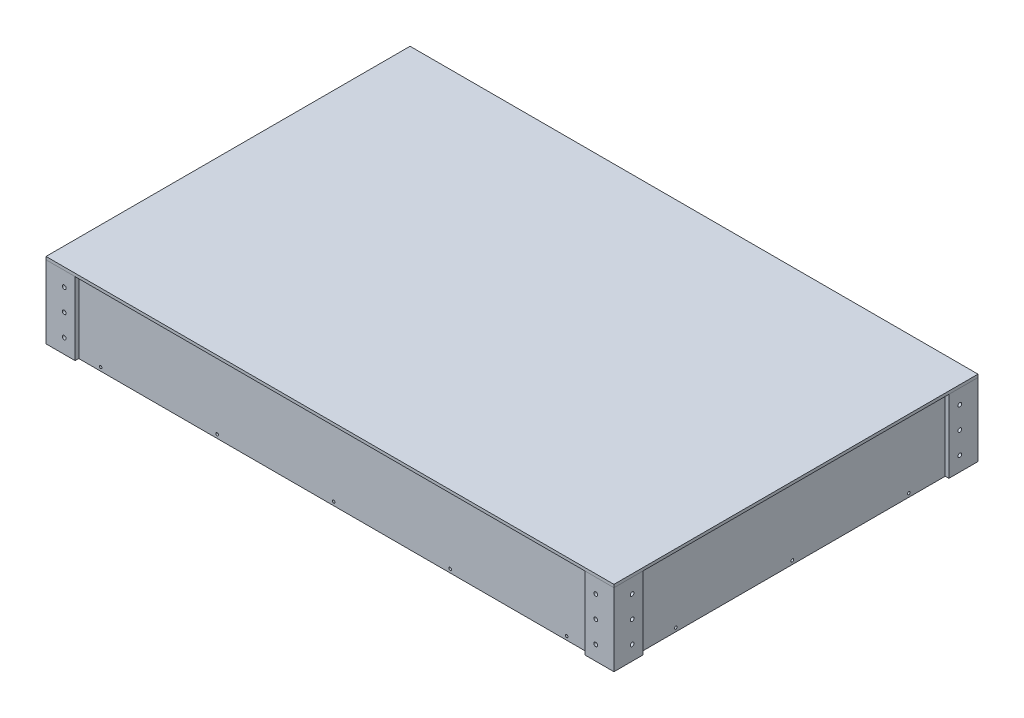
from build123d import *

# Parameters (mm, degrees)
SKETCH1_W                  = 482.6
SKETCH1_H                  = 304.8
BOSS_EXTRUDE1_DEPTH        = 6.35
BOSS_EXTRUDE2_DEPTH        = 57.15
BOSS_EXTRUDE2_DEPTH_BACK   = 6.35
SKETCH2_W                  = 482.6
SKETCH2_H                  = 3.175
BOSS_EXTRUDE2_2_DEPTH      = 57.15
BOSS_EXTRUDE2_2_DEPTH_BACK = 6.35
BOSS_EXTRUDE3_START        = -6.35
SKETCH3_W                  = 3.175
SKETCH3_H                  = 311.15
BOSS_EXTRUDE3_DEPTH        = 63.5
BOSS_EXTRUDE3_2_DEPTH      = 63.5
BOSS_EXTRUDE4_DEPTH        = 63.5
SKETCH5_R                  = 1.651
CUT_EXTRUDE1_DEPTH         = 406.170307556
SKETCH6_R                  = 1.651
CUT_EXTRUDE2_DEPTH         = 524.980822645
CUT_EXTRUDE3_DEPTH         = 406.170307556
CUT_EXTRUDE3_DEPTH_BACK    = 406.170307556
SKETCH7_R                  = 1.1811
SKETCH8_R                  = 1.1811
CUT_EXTRUDE4_DEPTH         = 521.980640835
SKETCH9_W                  = 495.3
SKETCH9_H                  = 317.5
BOSS_EXTRUDE5_DEPTH        = 2.54
SKETCH11_R                 = 1.651
CUT_EXTRUDE6_DEPTH         = 3.175
SKETCH13_R                 = 1.651
CUT_EXTRUDE8_DEPTH         = 301.15826009
SKETCH14_R                 = 6.35
CUT_EXTRUDE9_DEPTH         = 301.15826009


with BuildPart() as part:
    # Sketch1 → Boss-Extrude1 (new body)
    with BuildSketch(Plane(origin=(0, 0, 0), x_dir=(1, 0, 0), z_dir=(0, 1, 0))):
        Rectangle(SKETCH1_W, SKETCH1_H)
    extrude(amount=BOSS_EXTRUDE1_DEPTH)

    # Sketch13 → Cut-Extrude8 (cut, through all)
    with BuildSketch(Plane(origin=(0, 6.35, 0), x_dir=(1, 0, 0), z_dir=(0, 1, 0))):
        with Locations(Location((-228.6, 127, 0), (0, 0, 270))):
            Circle(SKETCH13_R)
        with Locations(Location((228.6, 127, 0), (0, 0, 270))):
            Circle(SKETCH13_R)
        with Locations(Location((228.6, -127, 0), (0, 0, 270))):
            Circle(SKETCH13_R)
        with Locations(Location((-228.6, -127, 0), (0, 0, 270))):
            Circle(SKETCH13_R)
    extrude(amount=-CUT_EXTRUDE8_DEPTH, mode=Mode.SUBTRACT)

    # Sketch14 → Cut-Extrude9 (cut, through all)
    with BuildSketch(Plane(origin=(0, 6.35, 0), x_dir=(1, 0, 0), z_dir=(0, 1, 0))):
        with Locations(Location((152.4, 127, 0), (0, 0, 270))):
            Circle(SKETCH14_R)
        with Locations(Location((152.4, -127, 0), (0, 0, 270))):
            Circle(SKETCH14_R)
        with Locations(Location((19.05, -127, 0), (0, 0, 270))):
            Circle(SKETCH14_R)
        with Locations(Location((19.05, 127, 0), (0, 0, 270))):
            Circle(SKETCH14_R)
        with Locations(Location((-114.3, 127, 0), (0, 0, 270))):
            Circle(SKETCH14_R)
        with Locations(Location((-114.3, -127, 0), (0, 0, 270))):
            Circle(SKETCH14_R)
    extrude(amount=-CUT_EXTRUDE9_DEPTH, mode=Mode.SUBTRACT)


with BuildPart() as body_2:
    # Sketch2 → Boss-Extrude2 (new, two sides: drawn at the far end of the back side and taken through both)
    with BuildSketch(Plane(origin=(0, 6.35, 0), x_dir=(1, 0, 0), z_dir=(0, 1, 0)).offset(-BOSS_EXTRUDE2_DEPTH_BACK)):
        with Locations((0, 153.9875)):
            Rectangle(SKETCH2_W, SKETCH2_H)
    extrude(amount=BOSS_EXTRUDE2_DEPTH + BOSS_EXTRUDE2_DEPTH_BACK)


with BuildPart() as body_3:
    # Sketch2 → Boss-Extrude2 2 (new, two sides: drawn at the far end of the back side and taken through both)
    with BuildSketch(Plane(origin=(0, 6.35, 0), x_dir=(1, 0, 0), z_dir=(0, 1, 0)).offset(-BOSS_EXTRUDE2_2_DEPTH_BACK)):
        with Locations((0, -153.9875)):
            Rectangle(SKETCH2_W, SKETCH2_H)
    extrude(amount=BOSS_EXTRUDE2_2_DEPTH + BOSS_EXTRUDE2_2_DEPTH_BACK)


with BuildPart() as body_4:
    # Sketch3 → Boss-Extrude3 (new body)
    with BuildSketch(Plane(origin=(0, 6.35, 0), x_dir=(1, 0, 0), z_dir=(0, 1, 0)).offset(BOSS_EXTRUDE3_START)):
        with Locations((-242.8875, 0)):
            Rectangle(SKETCH3_W, SKETCH3_H)
    extrude(amount=BOSS_EXTRUDE3_DEPTH)


with BuildPart() as body_5:
    # Sketch3 → Boss-Extrude3 2 (new body)
    with BuildSketch(Plane(origin=(0, 6.35, 0), x_dir=(1, 0, 0), z_dir=(0, 1, 0)).offset(BOSS_EXTRUDE3_START)):
        with Locations((242.8875, 0)):
            Rectangle(SKETCH3_W, SKETCH3_H)
    extrude(amount=BOSS_EXTRUDE3_2_DEPTH)


with BuildPart() as body_6:
    # Sketch4 → Boss-Extrude4 (new body)
    with BuildSketch(Plane.XZ):
        Polygon((-244.475, -155.575), (-222.25, -155.575), (-222.25, -158.75), (-247.65, -158.75), (-247.65, -133.35), (-244.475, -133.35), align=None)
    extrude(amount=-BOSS_EXTRUDE4_DEPTH)


with BuildPart() as body_7:
    # Mirror1: mirrored copy
    add(body_6.part.mirror(Plane(origin=(0, 0, 0), x_dir=(0, 0, 1), z_dir=(1, 0, 0))))


with BuildPart() as body_8:
    # Mirror2: mirrored copy
    add(body_6.part.mirror(Plane.XY))


with BuildPart() as body_9:
    # Mirror2 2: mirrored copy
    add(body_7.part.mirror(Plane.XY))


with BuildPart() as cut_extrude1_tool:
    # Sketch5 → Cut-Extrude1 (new, through all)
    with BuildSketch(Plane(origin=(0, 0, -155.575), x_dir=(-1, 0, 0), z_dir=(0, 0, -1))):
        with Locations((-231.775, 50.8)):
            Circle(SKETCH5_R)
        with Locations((-231.775, 31.75)):
            Circle(SKETCH5_R)
        with Locations((-231.775, 12.7)):
            Circle(SKETCH5_R)
    cut_extrude1 = extrude(amount=-CUT_EXTRUDE1_DEPTH)


with BuildPart() as body_2_1:
    add(body_2.part)

    # Cut-Extrude1: cut by cut_extrude1_tool
    add(cut_extrude1_tool.part, mode=Mode.SUBTRACT)


with BuildPart() as body_3_1:
    add(body_3.part)

    # Cut-Extrude1: cut by cut_extrude1_tool
    add(cut_extrude1_tool.part, mode=Mode.SUBTRACT)


with BuildPart() as body_9_1:
    add(body_9.part)

    # Cut-Extrude1: cut by cut_extrude1_tool
    add(cut_extrude1_tool.part, mode=Mode.SUBTRACT)


with BuildPart() as mirror3_tool:
    # Mirror3: Cut-Extrude1 across plane
    add(cut_extrude1.mirror(Plane(origin=(0, 0, 0), x_dir=(0, 0, 1), z_dir=(1, 0, 0))))


with BuildPart() as body_2_2:
    add(body_2_1.part)

    # Mirror3: cut by mirror3_tool
    add(mirror3_tool.part, mode=Mode.SUBTRACT)


with BuildPart() as body_3_2:
    add(body_3_1.part)

    # Mirror3: cut by mirror3_tool
    add(mirror3_tool.part, mode=Mode.SUBTRACT)


with BuildPart() as body_8_1:
    add(body_8.part)

    # Mirror3: cut by mirror3_tool
    add(mirror3_tool.part, mode=Mode.SUBTRACT)


with BuildPart() as cut_extrude2_tool:
    # Sketch6 → Cut-Extrude2 (new, through all)
    with BuildSketch(Plane.ZY.offset(247.65)):
        with Locations((-142.875, 50.8)):
            Circle(SKETCH6_R)
        with Locations((-142.875, 31.75)):
            Circle(SKETCH6_R)
        with Locations((-142.875, 12.7)):
            Circle(SKETCH6_R)
    cut_extrude2 = extrude(amount=-CUT_EXTRUDE2_DEPTH)


with BuildPart() as body_4_1:
    add(body_4.part)

    # Cut-Extrude2: cut by cut_extrude2_tool
    add(cut_extrude2_tool.part, mode=Mode.SUBTRACT)


with BuildPart() as body_5_1:
    add(body_5.part)

    # Cut-Extrude2: cut by cut_extrude2_tool
    add(cut_extrude2_tool.part, mode=Mode.SUBTRACT)


with BuildPart() as body_6_1:
    add(body_6.part)

    # Cut-Extrude2: cut by cut_extrude2_tool
    add(cut_extrude2_tool.part, mode=Mode.SUBTRACT)


with BuildPart() as body_7_1:
    add(body_7.part)

    # Cut-Extrude2: cut by cut_extrude2_tool
    add(cut_extrude2_tool.part, mode=Mode.SUBTRACT)


with BuildPart() as mirror4_tool:
    # Mirror4: Cut-Extrude2 across plane
    add(cut_extrude2.mirror(Plane.XY))


with BuildPart() as body_4_2:
    add(body_4_1.part)

    # Mirror4: cut by mirror4_tool
    add(mirror4_tool.part, mode=Mode.SUBTRACT)


with BuildPart() as body_5_2:
    add(body_5_1.part)

    # Mirror4: cut by mirror4_tool
    add(mirror4_tool.part, mode=Mode.SUBTRACT)


with BuildPart() as body_8_2:
    add(body_8_1.part)

    # Mirror4: cut by mirror4_tool
    add(mirror4_tool.part, mode=Mode.SUBTRACT)


with BuildPart() as body_9_2:
    add(body_9_1.part)

    # Mirror4: cut by mirror4_tool
    add(mirror4_tool.part, mode=Mode.SUBTRACT)


with BuildPart() as cut_extrude3_tool:
    # Sketch7 → Cut-Extrude3 (new, two sides: drawn at the far end of the back side and taken through both)
    with BuildSketch(Plane.XY.offset(155.575).offset(-CUT_EXTRUDE3_DEPTH_BACK)):
        with Locations((-203.2, 3.175)):
            Circle(SKETCH7_R)
        with Locations((0, 3.175)):
            Circle(SKETCH7_R)
        with Locations((203.2, 3.175)):
            Circle(SKETCH7_R)
        with Locations((101.6, 3.175)):
            Circle(SKETCH7_R)
        with Locations((-101.6, 3.175)):
            Circle(SKETCH7_R)
    extrude(amount=CUT_EXTRUDE3_DEPTH + CUT_EXTRUDE3_DEPTH_BACK)


with BuildPart() as body_3_3:
    add(body_3_2.part)

    # Cut-Extrude3: cut by cut_extrude3_tool
    add(cut_extrude3_tool.part, mode=Mode.SUBTRACT)


with BuildPart() as body_2_3:
    add(body_2_2.part)

    # Cut-Extrude3: cut by cut_extrude3_tool
    add(cut_extrude3_tool.part, mode=Mode.SUBTRACT)

    # Sketch11 → Cut-Extrude6 (cut)
    with BuildSketch(Plane(origin=(0, 0, -155.575), x_dir=(-1, 0, 0), z_dir=(0, 0, -1))):
        with Locations((-215.9, 57.15)):
            Circle(SKETCH11_R)
        with Locations((-107.95, 57.15)):
            Circle(SKETCH11_R)
        with Locations((0, 57.15)):
            Circle(SKETCH11_R)
        with Locations((107.95, 57.15)):
            Circle(SKETCH11_R)
        with Locations((215.9, 57.15)):
            Circle(SKETCH11_R)
    extrude(amount=-CUT_EXTRUDE6_DEPTH, mode=Mode.SUBTRACT)


with BuildPart() as cut_extrude4_tool:
    # Sketch8 → Cut-Extrude4 (new, through all)
    with BuildSketch(Plane(origin=(244.475, 0, 0), x_dir=(0, 0, -1), z_dir=(1, 0, 0))):
        with Locations((0, 3.175)):
            Circle(SKETCH8_R)
        with Locations((101.6, 3.175)):
            Circle(SKETCH8_R)
        with Locations((-101.6, 3.175)):
            Circle(SKETCH8_R)
    extrude(amount=-CUT_EXTRUDE4_DEPTH)


with BuildPart() as body_5_3:
    add(body_5_2.part)

    # Cut-Extrude4: cut by cut_extrude4_tool
    add(cut_extrude4_tool.part, mode=Mode.SUBTRACT)


with BuildPart() as body_4_3:
    add(body_4_2.part)

    # Cut-Extrude4: cut by cut_extrude4_tool
    add(cut_extrude4_tool.part, mode=Mode.SUBTRACT)


with BuildPart() as body_10:
    # Sketch9 → Boss-Extrude5 (new body)
    with BuildSketch(Plane(origin=(0, 63.5, 0), x_dir=(1, 0, 0), z_dir=(0, 1, 0))):
        Rectangle(SKETCH9_W, SKETCH9_H)
    extrude(amount=BOSS_EXTRUDE5_DEPTH)


solid = Compound([part.part, body_6_1.part, body_7_1.part, body_8_2.part, body_9_2.part, body_3_3.part, body_2_3.part, body_5_3.part, body_4_3.part, body_10.part])
